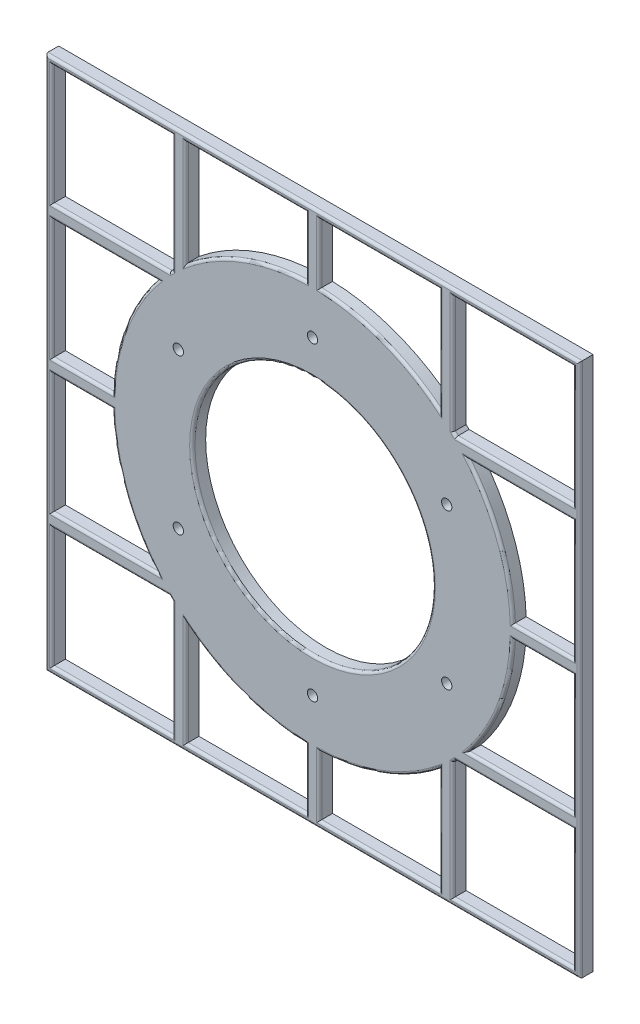
from build123d import *

# Parameters (mm, degrees)
SKETCH2_W           = 200
SKETCH2_H           = 200
SKETCH2_R           = 45
BOSS_EXTRUDE1_DEPTH = 5
FILLET2_R           = 1
SKETCH3_R           = 1.925
CUT_EXTRUDE1_DEPTH  = 10


with BuildPart() as part:
    # Sketch2 → Boss-Extrude1 (new body)
    with BuildSketch(Plane.XY):
        Rectangle(SKETCH2_W, SKETCH2_H)
        Circle(SKETCH2_R, mode=Mode.SUBTRACT)
        with BuildLine():
            Line((-47.5, -97.5), (-2.5, -97.5))
            Line((-2.5, -97.5), (-2.5, -74.958321753))
            ThreePointArc((-2.5, -74.958321753), (-26.3922243, -70.202923703), (-47.5, -58.040933831))
            Line((-47.5, -58.040933831), (-47.5, -97.5))
        make_face(mode=Mode.SUBTRACT)
        with BuildLine():
            Line((-97.5, -97.5), (-52.5, -97.5))
            Line((-52.5, -97.5), (-52.5, -53.560713214))
            ThreePointArc((-52.5, -53.560713214), (-53.033008589, -53.033008589), (-53.560713214, -52.5))
            Line((-53.560713214, -52.5), (-97.5, -52.5))
            Line((-97.5, -52.5), (-97.5, -97.5))
        make_face(mode=Mode.SUBTRACT)
        with BuildLine():
            Line((2.5, -97.5), (47.5, -97.5))
            Line((47.5, -97.5), (47.5, -58.040933831))
            ThreePointArc((47.5, -58.040933831), (26.3922243, -70.202923703), (2.5, -74.958321753))
            Line((2.5, -74.958321753), (2.5, -97.5))
        make_face(mode=Mode.SUBTRACT)
        with BuildLine():
            Line((52.5, -97.5), (97.5, -97.5))
            Line((97.5, -97.5), (97.5, -52.5))
            Line((97.5, -52.5), (53.560713214, -52.5))
            ThreePointArc((53.560713214, -52.5), (53.033008589, -53.033008589), (52.5, -53.560713214))
            Line((52.5, -53.560713214), (52.5, -97.5))
        make_face(mode=Mode.SUBTRACT)
        with BuildLine():
            Line((58.040933831, -47.5), (97.5, -47.5))
            Line((97.5, -47.5), (97.5, -2.5))
            Line((97.5, -2.5), (74.958321753, -2.5))
            ThreePointArc((74.958321753, -2.5), (70.202923703, -26.3922243), (58.040933831, -47.5))
        make_face(mode=Mode.SUBTRACT)
        with BuildLine():
            Line((74.958321753, 2.5), (97.5, 2.5))
            Line((97.5, 2.5), (97.5, 47.5))
            Line((97.5, 47.5), (58.040933831, 47.5))
            ThreePointArc((58.040933831, 47.5), (70.202923703, 26.3922243), (74.958321753, 2.5))
        make_face(mode=Mode.SUBTRACT)
        with BuildLine():
            Line((-47.5, 58.040933831), (-47.5, 97.5))
            Line((-47.5, 97.5), (-2.5, 97.5))
            Line((-2.5, 97.5), (-2.5, 74.958321753))
            ThreePointArc((-2.5, 74.958321753), (-26.3922243, 70.202923703), (-47.5, 58.040933831))
        make_face(mode=Mode.SUBTRACT)
        with BuildLine():
            Line((2.5, 74.958321753), (2.5, 97.5))
            Line((2.5, 97.5), (47.5, 97.5))
            Line((47.5, 97.5), (47.5, 58.040933831))
            ThreePointArc((47.5, 58.040933831), (26.3922243, 70.202923703), (2.5, 74.958321753))
        make_face(mode=Mode.SUBTRACT)
        with BuildLine():
            Line((53.560713214, 52.5), (97.5, 52.5))
            Line((97.5, 52.5), (97.5, 97.5))
            Line((97.5, 97.5), (52.5, 97.5))
            Line((52.5, 97.5), (52.5, 53.560713214))
            ThreePointArc((52.5, 53.560713214), (53.033008589, 53.033008589), (53.560713214, 52.5))
        make_face(mode=Mode.SUBTRACT)
        with BuildLine():
            Line((-97.5, -47.5), (-58.040933831, -47.5))
            ThreePointArc((-58.040933831, -47.5), (-70.202923703, -26.3922243), (-74.958321753, -2.5))
            Line((-74.958321753, -2.5), (-97.5, -2.5))
            Line((-97.5, -2.5), (-97.5, -47.5))
        make_face(mode=Mode.SUBTRACT)
        with BuildLine():
            Line((-97.5, 2.5), (-74.958321753, 2.5))
            ThreePointArc((-74.958321753, 2.5), (-70.202923703, 26.3922243), (-58.040933831, 47.5))
            Line((-58.040933831, 47.5), (-97.5, 47.5))
            Line((-97.5, 47.5), (-97.5, 2.5))
        make_face(mode=Mode.SUBTRACT)
        with BuildLine():
            Line((-97.5, 52.5), (-53.560713214, 52.5))
            ThreePointArc((-53.560713214, 52.5), (-53.033008589, 53.033008589), (-52.5, 53.560713214))
            Line((-52.5, 53.560713214), (-52.5, 97.5))
            Line((-52.5, 97.5), (-97.5, 97.5))
            Line((-97.5, 97.5), (-97.5, 52.5))
        make_face(mode=Mode.SUBTRACT)
    extrude(amount=BOSS_EXTRUDE1_DEPTH)

    # Fillet2
    fillet2_edges = [part.edges().sort_by_distance(p)[0] for p in [
        (97.5, 25, 5),
        (77.770466916, 47.5, 5),
        (70.202923703, 26.3922243, 5),
        (86.229160876, 2.5, 5),
        (47.5, 77.770466916, 5),
        (25, 97.5, 5),
        (2.5, 86.229160876, 5),
        (26.3922243, 70.202923703, 5),
        (97.5, 75, 5),
        (75, 97.5, 5),
        (52.5, 75.530356607, 5),
        (53.033008589, 53.033008589, 5),
        (75.530356607, 52.5, 5),
        (-100, 0, 5),
        (-97.5, -25, 5),
        (-77.770466916, -47.5, 5),
        (-70.202923703, -26.3922243, 5),
        (-86.229160876, -2.5, 5),
        (-97.5, 25, 5),
        (-86.229160876, 2.5, 5),
        (-70.202923703, 26.3922243, 5),
        (-77.770466916, 47.5, 5),
        (-52.5, 75.530356607, 5),
        (-75, 97.5, 5),
        (-97.5, 75, 5),
        (0, -100, 5),
        (-75.530356607, 52.5, 5),
        (-53.033008589, 53.033008589, 5),
        (-45, 0, 5),
        (-97.5, -75, 5),
        (-75, -97.5, 5),
        (-52.5, -75.530356607, 5),
        (-53.033008589, -53.033008589, 5),
        (-75.530356607, -52.5, 5),
        (-26.3922243, 70.202923703, 5),
        (-2.5, 86.229160876, 5),
        (-25, 97.5, 5),
        (-47.5, 77.770466916, 5),
        (-47.5, -77.770466916, 5),
        (-25, -97.5, 5),
        (-2.5, -86.229160876, 5),
        (-26.3922243, -70.202923703, 5),
        (100, 0, 5),
        (2.5, -86.229160876, 5),
        (25, -97.5, 5),
        (47.5, -77.770466916, 5),
        (26.3922243, -70.202923703, 5),
        (97.5, -75, 5),
        (75.530356607, -52.5, 5),
        (53.033008589, -53.033008589, 5),
        (52.5, -75.530356607, 5),
        (75, -97.5, 5),
        (97.5, -25, 5),
        (86.229160876, -2.5, 5),
        (70.202923703, -26.3922243, 5),
        (77.770466916, -47.5, 5),
        (0, 100, 5),
    ]]
    fillet(fillet2_edges, radius=FILLET2_R)

    # Sketch3 → Cut-Extrude1 (cut)
    with BuildSketch(Plane.XY):
        with Locations(Location((0, 58, 0), (0, 0, 180))):
            Circle(SKETCH3_R)
        with Locations(Location((50.229473419, 29, 0), (0, 0, 180))):
            Circle(SKETCH3_R)
        with Locations(Location((50.229473419, -29, 0), (0, 0, 180))):
            Circle(SKETCH3_R)
        with Locations(Location((0, -58, 0), (0, 0, 180))):
            Circle(SKETCH3_R)
        with Locations(Location((-50.229473419, -29, 0), (0, 0, 180))):
            Circle(SKETCH3_R)
        with Locations(Location((-50.229473419, 29, 0), (0, 0, 180))):
            Circle(SKETCH3_R)
    extrude(amount=CUT_EXTRUDE1_DEPTH, mode=Mode.SUBTRACT)


solid = part.part
